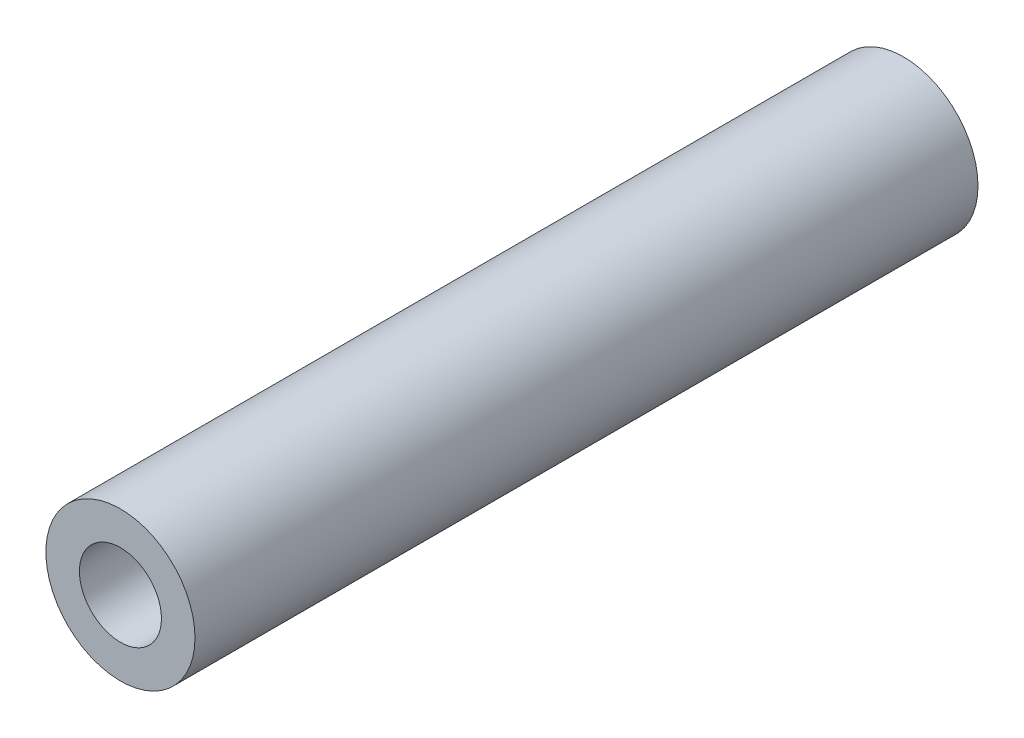
from build123d import *

# Parameters (mm, degrees)
SKETCH_1_R         = 3
EXTRUDE_1_DEPTH    = 31.5
HOLE_WIZARD_M4_1_D = 3.3


with BuildPart() as part:
    # 草图1 → 凸台-拉伸1 (new body)
    with BuildSketch(Plane.XY):
        Circle(SKETCH_1_R)
    extrude(amount=EXTRUDE_1_DEPTH)

    # M4 螺纹孔1 (through all)
    with Locations(Plane.XY.offset(31.5)):
        with Locations((0, 0)):
            Hole(HOLE_WIZARD_M4_1_D / 2)


solid = part.part
